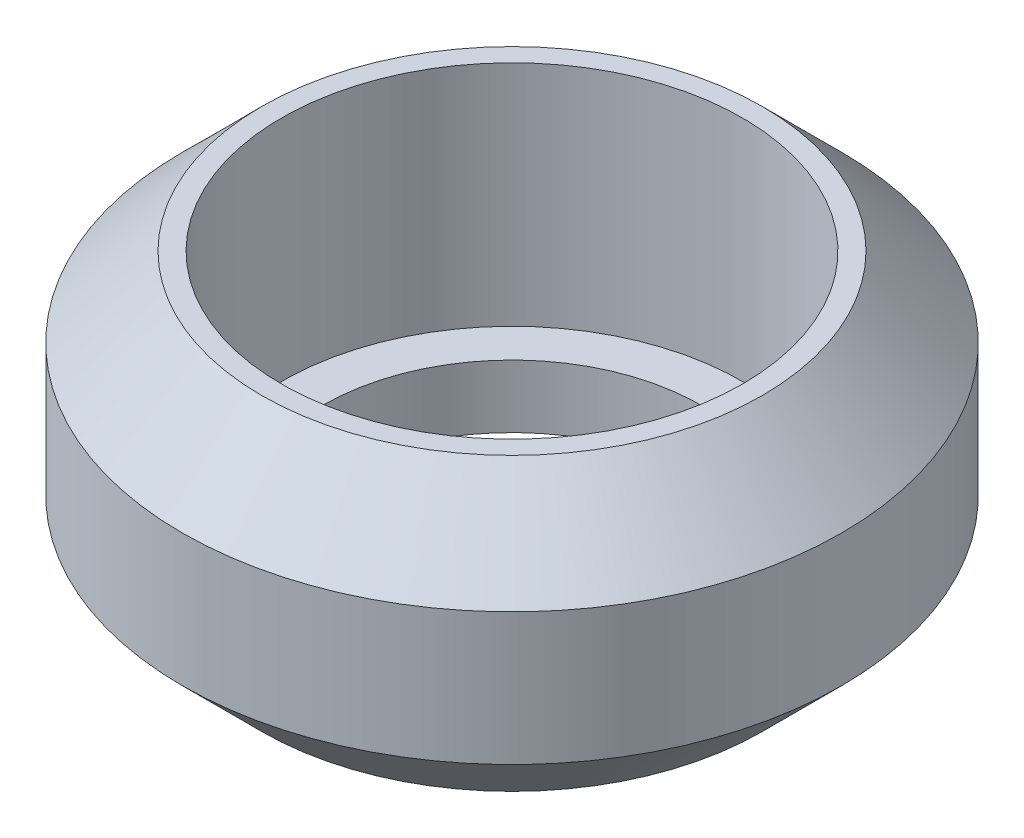
from build123d import *


with BuildPart() as part:
    # Roller Profile Sketch → Revolve 2 (revolve)
    with BuildSketch(Plane.XY, mode=Mode.PRIVATE) as revolve_2_sk:
        Polygon((-0.762, -5.588), (1.5875, -5.588), (1.5875, -3.175), (0, -3.175), (0, 5.588), (-0.762, 5.588), (-3.81, 2.54), (-3.81, -2.54), align=None)
    revolve(revolve_2_sk.sketch.rotate(Axis((8.8519, -5.810023832, 0), (0, 1, 0)), 180), axis=Axis((8.8519, -5.810023832, 0), (0, 1, 0)))


solid = part.part
